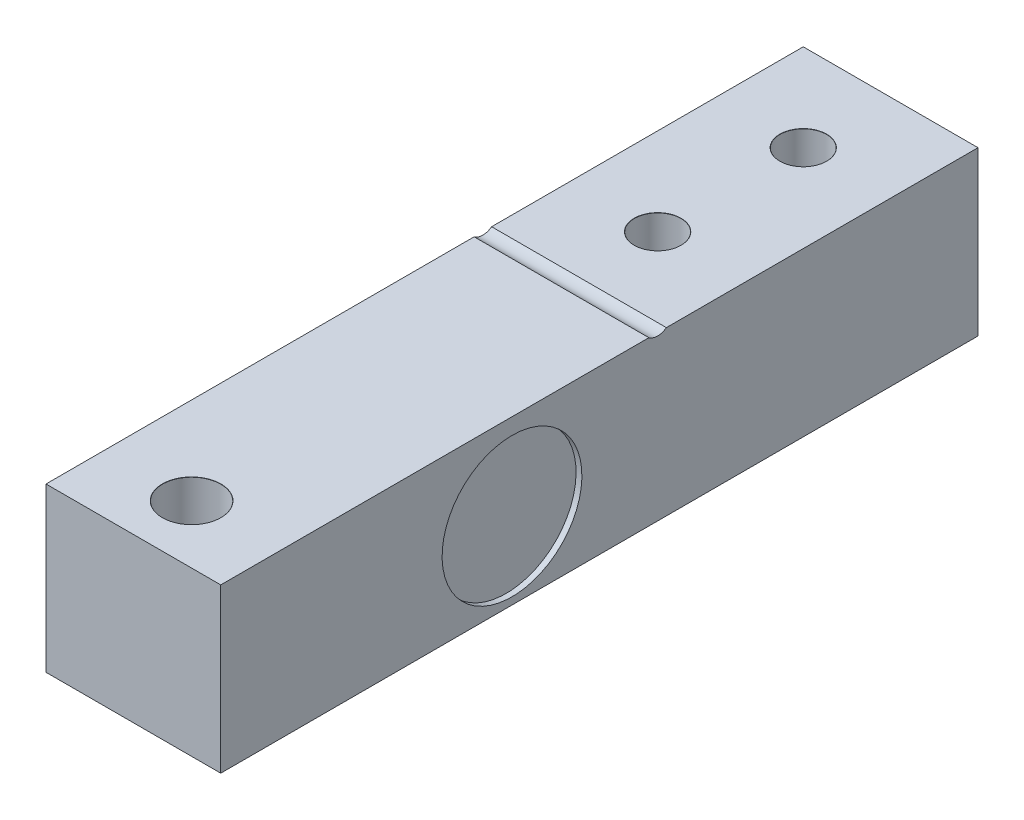
from build123d import *

# Parameters (mm, degrees)
SKETCH_1_W                        = 30
SKETCH_1_H                        = 28
EXTRUDE_1_DEPTH                   = 65
SKETCH_2_R                        = 2.5
CUT_EXTRUDE_1_DEPTH               = 73.945184899
HOLE_WIZARD_8_0_8_1_D             = 8
HOLE_WIZARD_8_0_8_1_CSINK_D       = 8.05
HOLE_WIZARD_8_0_8_1_CSINK_ANGLE   = 90
HOLE_WIZARD_10_0_10_1_D           = 10
HOLE_WIZARD_10_0_10_1_CSINK_D     = 10.05
HOLE_WIZARD_10_0_10_1_CSINK_ANGLE = 90
SKETCH_7_R                        = 12
CUT_EXTRUDE_2_DEPTH               = 1
SKETCH_9_R                        = 12
CUT_EXTRUDE_3_DEPTH               = 1


with BuildPart() as part:
    # 草图1 → 凸台-拉伸1 (new, symmetric)
    with BuildSketch(Plane.XY):
        Rectangle(SKETCH_1_W, SKETCH_1_H)
    extrude(amount=EXTRUDE_1_DEPTH, both=True)

    # 草图2 → 切除-拉伸1 (cut, through all)
    with BuildSketch(Plane.ZY.offset(15)):
        with Locations((-10, 16)):
            Circle(SKETCH_2_R)
    extrude(amount=-CUT_EXTRUDE_1_DEPTH, mode=Mode.SUBTRACT)

    # Ø8.0 (8) 直径孔1 (through all)
    with Locations(Plane(origin=(0, 14, 0), x_dir=(1, 0, 0), z_dir=(0, 1, 0))):
        with Locations((0, 25), (0, 50)):
            CounterSinkHole(HOLE_WIZARD_8_0_8_1_D / 2, HOLE_WIZARD_8_0_8_1_CSINK_D / 2, counter_sink_angle=HOLE_WIZARD_8_0_8_1_CSINK_ANGLE)

    # Ø10.0 (10) 直径孔1 (through all)
    with Locations(Plane(origin=(0, 14, 0), x_dir=(1, 0, 0), z_dir=(0, 1, 0))):
        with Locations((0, -55)):
            CounterSinkHole(HOLE_WIZARD_10_0_10_1_D / 2, HOLE_WIZARD_10_0_10_1_CSINK_D / 2, counter_sink_angle=HOLE_WIZARD_10_0_10_1_CSINK_ANGLE)

    # 草图7 → 切除-拉伸2 (cut)
    with BuildSketch(Plane.ZY.offset(15)):
        with Locations(Location((15, 0, 0), (0, 0, 270))):
            Circle(SKETCH_7_R)
    extrude(amount=-CUT_EXTRUDE_2_DEPTH, mode=Mode.SUBTRACT)

    # 草图9 → 切除-拉伸3 (cut)
    with BuildSketch(Plane(origin=(15, 0, 0), x_dir=(0, 0, -1), z_dir=(1, 0, 0))):
        with Locations(Location((-15, -0.777034021, 0), (0, 0, 90))):
            Circle(SKETCH_9_R)
    extrude(amount=-CUT_EXTRUDE_3_DEPTH, mode=Mode.SUBTRACT)


solid = part.part
